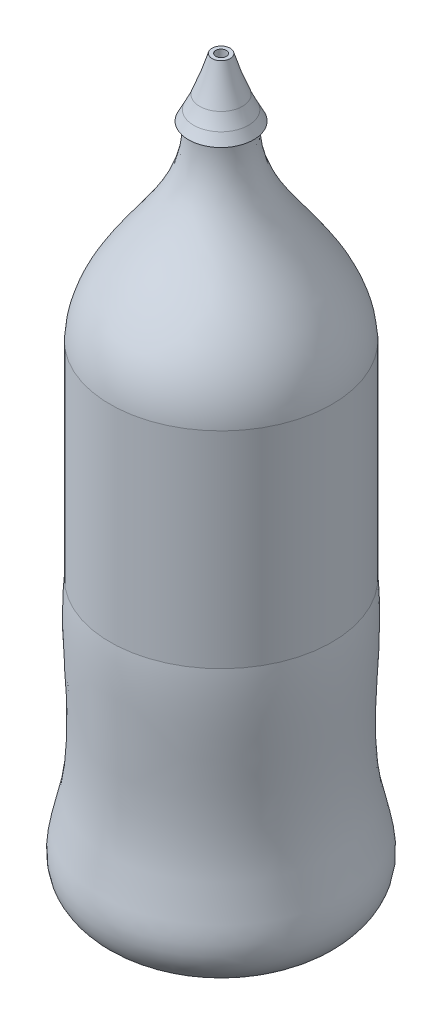
from build123d import *

# Parameters (mm, degrees)
SKETCH4_R          = 2.5
CUT_EXTRUDE1_DEPTH = 10


with BuildPart() as part:
    # Sketch1 → Revolve1 (revolve)
    with BuildSketch(Plane.XY, mode=Mode.PRIVATE) as revolve1_sk:
        with BuildLine():
            Line((0, 0), (0, 320))
            Line((0, 320), (0, 331.054218753))
            Line((0, 331.054218753), (13, 331.054218753))
            Line((13, 331.054218753), (13, 321.576985446))
            Line((13, 321.576985446), (15.433464657, 320))
            Line((15.433464657, 320), (13, 320))
            add(Edge.make_bspline(
                [(13, 320), (11.878091836, 283.27832547), (50.721966152, 265.475319412), (52.567488524, 229.937180409)],
                knots=[0, 0, 0, 0, 1, 1, 1, 1], degree=3))
            Line((52.567488524, 229.937180409), (52.567488524, 132.323370386))
            add(Edge.make_bspline(
                [(52.567488524, 132.323370386), (55.245477634, 101.880070943), (44.248099594, 56.601355946), (64.997390408, 10.768245845), (44.287893313, 0)],
                knots=[0, 0, 0, 0, 0.662490956, 1, 1, 1, 1], degree=3))
            Line((44.287893313, 0), (0, 0))
        make_face()
    revolve(revolve1_sk.sketch.rotate(Axis((0, 0, 0), (0, 1, 0)), 90), axis=Axis((0, 0, 0), (0, 1, 0)))

    # Sketch2 → Revolve2 (revolve)
    with BuildSketch(Plane.XY, mode=Mode.PRIVATE) as revolve2_sk:
        with BuildLine():
            Line((4.280433448, 347.757883162), (0, 347.757883162))
            Line((0, 347.757883162), (0, 320))
            Line((0, 320), (15.433464657, 320))
            ThreePointArc((15.433464657, 320), (9.079705094, 333.566647373), (4.280433448, 347.757883162))
        make_face()
    revolve(revolve2_sk.sketch.rotate(Axis((0, 347.757883162, 0), (0, -1, 0)), 180), axis=Axis((0, 347.757883162, 0), (0, -1, 0)))

    # Sketch3 → Cut-Revolve1 (revolve, cut)
    with BuildSketch(Plane.XY, mode=Mode.PRIVATE) as cut_revolve1_sk:
        with BuildLine():
            Line((9.919015749, 331.054218753), (13, 331.054218753))
            Line((13, 331.054218753), (13, 324.743018777))
            ThreePointArc((13, 324.743018777), (11.37547872, 327.857597644), (9.919015749, 331.054218753))
        make_face()
    revolve(cut_revolve1_sk.sketch.rotate(Axis((0, 331.054218753, 0), (0, 1, 0)), 180), axis=Axis((0, 331.054218753, 0), (0, 1, 0)), mode=Mode.SUBTRACT)

    # Sketch4 → Cut-Extrude1 (cut)
    with BuildSketch(Plane(origin=(0, 347.757883162, 0), x_dir=(1, 0, 0), z_dir=(0, 1, 0))):
        with Locations(Location((0, 0, 0), (0, 0, 180))):
            Circle(SKETCH4_R)
    extrude(amount=-CUT_EXTRUDE1_DEPTH, mode=Mode.SUBTRACT)


solid = part.part
